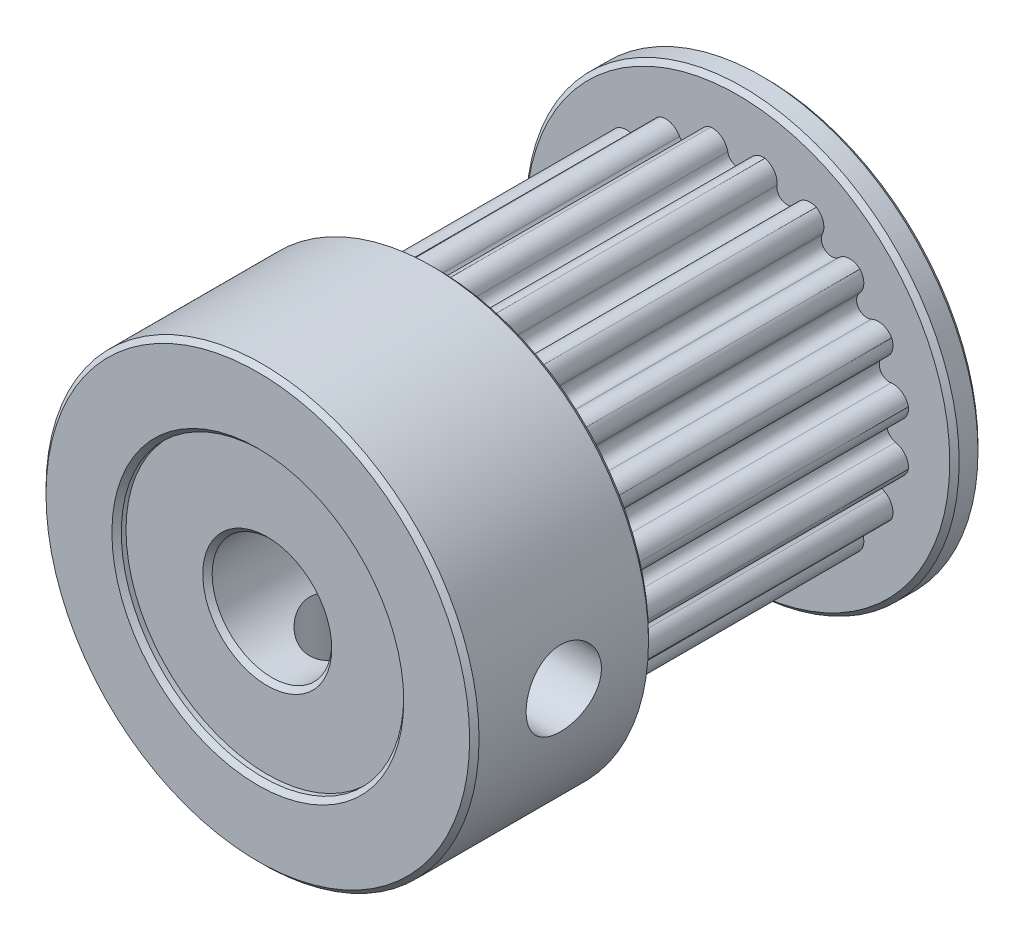
from build123d import *

# Parameters (mm, degrees)
ESQUISSE1_R                  = 11.5
ESQUISSE1_R_2                = 3.175
BOSS_EXTRU_1_DEPTH           = 27
ESQUISSE2_R                  = 11.5
ESQUISSE2_R_2                = 9.17
ENL_V_MAT_EXTRU_1_DEPTH      = 16
ENL_V_START                  = 16
ENL_V_MAT_EXTRU_2_DEPTH      = 16
R_P_TITION_CIRCULAIRE1_COUNT = 20
ESQUISSE4_R                  = 2
ENL_V_MAT_EXTRU_3_DEPTH      = 16
R_P_TITION_CIRCULAIRE2_COUNT = 2
R_P_TITION_CIRCULAIRE2_ANGLE = 90
ESQUISSE5_R                  = 7.5
ENL_V_MAT_EXTRU_4_DEPTH      = 0.5
CHANFREIN1_SIZE              = 0.25


with BuildPart() as part:
    # Esquisse1 → Boss.-Extru.1 (new body)
    with BuildSketch(Plane.XY):
        Circle(ESQUISSE1_R)
        Circle(ESQUISSE1_R_2, mode=Mode.SUBTRACT)
    extrude(amount=BOSS_EXTRU_1_DEPTH)

    # Esquisse2 → Enlèv. mat.-Extru.1 (cut)
    with BuildSketch(Plane(origin=(0, 0, 1.5), x_dir=(-1, 0, 0), z_dir=(0, 0, -1))):
        Circle(ESQUISSE2_R)
        Circle(ESQUISSE2_R_2, mode=Mode.SUBTRACT)
    extrude(amount=-ENL_V_MAT_EXTRU_1_DEPTH, mode=Mode.SUBTRACT)

    # Esquisse3 → Enlèv. mat.-Extru.2 (cut)
    with BuildSketch(Plane(origin=(0, 0, 17.5), x_dir=(-1, 0, 0), z_dir=(0, 0, -1)).offset(ENL_V_START)):
        with BuildLine():
            ThreePointArc((-1.5, 9.046485505), (-0.88232463, 8.905445978), (-0.541125011, 8.371594096))
            ThreePointArc((-0.541125011, 8.371594096), (0, 7.92), (0.541125011, 8.371594096))
            ThreePointArc((0.541125011, 8.371594096), (0.88232463, 8.905445978), (1.5, 9.046485505))
            ThreePointArc((1.5, 9.046485505), (0, 9.17), (-1.5, 9.046485505))
        make_face()
    enl_v_mat_extru_2 = extrude(amount=-ENL_V_MAT_EXTRU_2_DEPTH, mode=Mode.SUBTRACT)

    # Répétition circulaire1: Enlèv. mat.-Extru.2 ×20 about axis
    r_p_tition_circulaire1_axis = Axis((0, 0, 0), (0, 0, 1))
    for i in range(1, R_P_TITION_CIRCULAIRE1_COUNT):
        add(enl_v_mat_extru_2.rotate(r_p_tition_circulaire1_axis, i * 360 / R_P_TITION_CIRCULAIRE1_COUNT), mode=Mode.SUBTRACT)

    # Esquisse4 → Enlèv. mat.-Extru.3 (cut)
    with BuildSketch(Plane(origin=(0, 0, 0), x_dir=(1, 0, 0), z_dir=(0, 1, 0))):
        with Locations(Location((0, -22.25, 0), (0, 0, 270))):
            Circle(ESQUISSE4_R)
    enl_v_mat_extru_3 = extrude(amount=-ENL_V_MAT_EXTRU_3_DEPTH, mode=Mode.SUBTRACT)

    # Répétition circulaire2: Enlèv. mat.-Extru.3 ×2 about axis
    r_p_tition_circulaire2_axis = Axis((0, 0, 27), (0, 0, 1))
    for i in range(1, R_P_TITION_CIRCULAIRE2_COUNT):
        add(enl_v_mat_extru_3.rotate(r_p_tition_circulaire2_axis, i * R_P_TITION_CIRCULAIRE2_ANGLE / (R_P_TITION_CIRCULAIRE2_COUNT - 1)), mode=Mode.SUBTRACT)

    # Esquisse5 → Enlèv. mat.-Extru.4 (cut)
    with BuildSketch(Plane(origin=(0, 0, 0), x_dir=(-1, 0, 0), z_dir=(0, 0, -1))):
        Circle(ESQUISSE5_R)
    enl_v_mat_extru_4 = extrude(amount=-ENL_V_MAT_EXTRU_4_DEPTH, mode=Mode.SUBTRACT)

    # Symétrie1: Enlèv. mat.-Extru.4 across plane
    add(enl_v_mat_extru_4.mirror(Plane(origin=(0, 0, 13.5), x_dir=(1, 0, 0), z_dir=(0, 0, -1))), mode=Mode.SUBTRACT)

    # Chanfrein1
    chanfrein1_edges = [part.edges().sort_by_distance(p)[0] for p in [
        (-11.5, 0, 17.5),
        (-11.5, 0, 1.5),
        (-3.175, 0, 0.5),
        (7.5, 0, 0),
        (-11.5, 0, 0),
        (7.5, 0, 27),
        (-3.175, 0, 26.5),
        (-11.5, 0, 27),
    ]]
    chamfer(chanfrein1_edges, length=CHANFREIN1_SIZE)


solid = part.part
